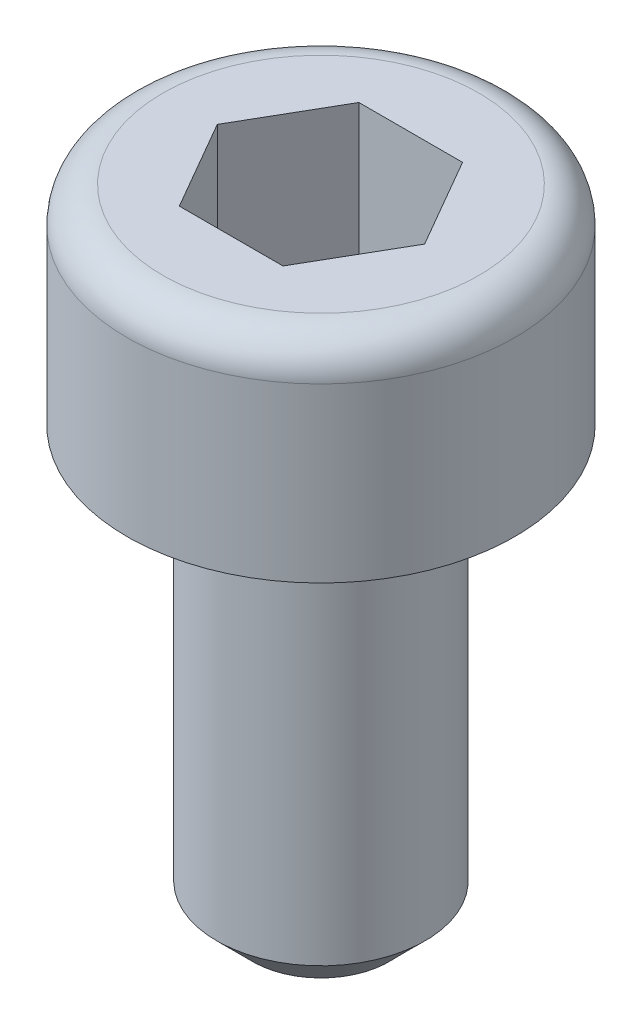
from build123d import *

# Parameters (mm, degrees)
ENL_V_MAT_EXTRU_1_DEPTH = 2


with BuildPart() as part:
    # Esquisse1 → Révolution1 (revolve)
    with BuildSketch(Plane.XY):
        with BuildLine():
            Line((0, 2.9), (-2.2, 2.9))
            ThreePointArc((-2.2, 2.9), (-2.553553391, 2.753553391), (-2.7, 2.4))
            Line((-2.7, 2.4), (-2.7, 0))
            Line((-2.7, 0), (-1.45, 0))
            Line((-1.45, 0), (-1.45, -5.5))
            Line((-1.45, -5.5), (-0.95, -6))
            Line((-0.95, -6), (0, -6))
            Line((0, -6), (0, 2.9))
        make_face()
    revolve(axis=Axis((0, 15.825722622, 0), (0, -1, 0)))

    # Esquisse2 → Enlèv. mat.-Extru.1 (cut)
    with BuildSketch(Plane(origin=(0, 2.9, 0), x_dir=(-1, 0, 0), z_dir=(0, 1, 0))):
        Polygon((-1.443375673, 0), (-0.721687836, -1.25), (0.721687836, -1.25), (1.443375673, 0), (0.721687836, 1.25), (-0.721687836, 1.25), align=None)
    extrude(amount=-ENL_V_MAT_EXTRU_1_DEPTH, mode=Mode.SUBTRACT)


solid = part.part
